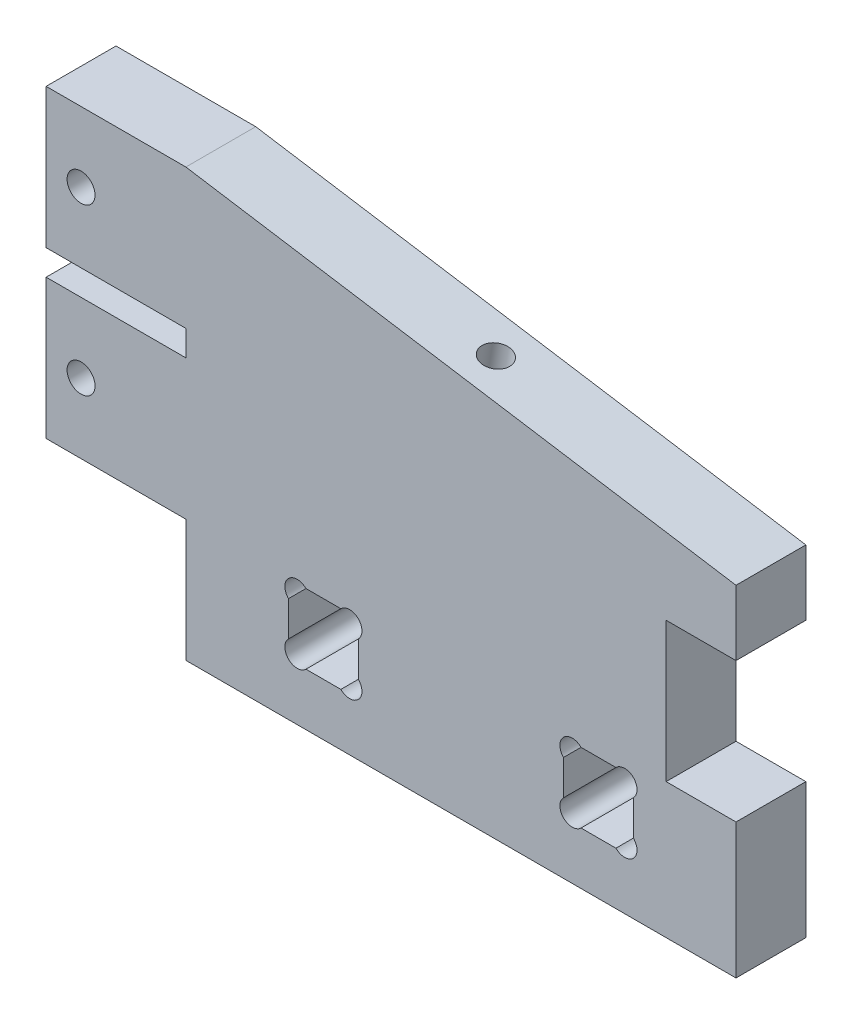
from build123d import *

# Parameters (mm, degrees)
BOSS_EXTRUDE1_DEPTH = 12.7
SKETCH2_R           = 2.54
SKETCH2_W           = 19.05
SKETCH2_H           = 55.44118298
CUT_EXTRUDE2_DEPTH  = 149.871187129
SKETCH3_W           = 100
SKETCH3_H           = 12.958545622
CUT_EXTRUDE3_DEPTH  = 149.871187129
SKETCH5_W           = 100
SKETCH5_H           = 9.525
BOSS_EXTRUDE3_DEPTH = 12.7
SKETCH4_R           = 2.24536
CUT_EXTRUDE4_DEPTH  = 154.464616373
SKETCH6_R           = 4.091253385
SKETCH6_R_2         = 6.05236999
SKETCH6_W           = 12.7
SKETCH6_H           = 25.4
BOSS_EXTRUDE4_DEPTH = 12.7
SKETCH7_R           = 2.54
CUT_EXTRUDE5_DEPTH  = 154.464616373
CUT_EXTRUDE6_DEPTH  = 154.464616373
SKETCH9_R           = 2.54
CUT_EXTRUDE7_DEPTH  = 9.525


with BuildPart() as part:
    # Sketch1 → Boss-Extrude1 (new body)
    with BuildSketch(Plane.XY):
        Polygon((31.75, -68.141601517), (31.75, -55.44118298), (0, -55.44118298), (0, -30.04118298), (19.05, -30.04118298), (31.75, -30.04118298), (31.75, -25.4), (19.05, -25.4), (0, -25.4), (0, 0), (19.05, 0), (31.75, 0), (131.75, -15.838444032), (131.75, -68.141601517), align=None)
    extrude(amount=BOSS_EXTRUDE1_DEPTH)

    # Sketch2 → Cut-Extrude2 (cut, through all)
    with BuildSketch(Plane.XY.offset(12.7)):
        with Locations((25.4, -12.7)):
            Circle(SKETCH2_R)
        with Locations(Location((25.4, -42.74118298, 0), (0, 0, 180))):
            Circle(SKETCH2_R)
        with Locations((9.525, -27.72059149)):
            Rectangle(SKETCH2_W, SKETCH2_H)
    extrude(amount=-CUT_EXTRUDE2_DEPTH, mode=Mode.SUBTRACT)

    # Sketch3 → Cut-Extrude3 (cut, through all)
    with BuildSketch(Plane.XY.offset(12.7)):
        with Locations((81.75, -74.620455791)):
            Rectangle(SKETCH3_W, SKETCH3_H)
    extrude(amount=-CUT_EXTRUDE3_DEPTH, mode=Mode.SUBTRACT)

    # Sketch5 → Boss-Extrude3 (add)
    with BuildSketch(Plane.XY.offset(12.7)):
        with Locations((81.75, -72.90368298)):
            Rectangle(SKETCH5_W, SKETCH5_H)
    extrude(amount=-BOSS_EXTRUDE3_DEPTH)

    # Sketch4 → Cut-Extrude4 (cut, through all)
    with BuildSketch(Plane.XY.offset(12.7)):
        with BuildLine():
            ThreePointArc((53.575418537, -55.44118298), (50.399790718, -55.440973698), (50.4, -58.616601517))
            Line((50.4, -58.616601517), (50.4, -55.44118298))
            Line((50.4, -55.44118298), (53.575418537, -55.44118298))
        make_face()
        with BuildLine():
            Line((50.4, -55.44118298), (50.4, -58.616601517))
            ThreePointArc((50.4, -58.616601517), (52.846898781, -59.103068495), (54.23286, -57.02868298))
            ThreePointArc((54.23286, -57.02868298), (54.06199877, -56.169557621), (53.575418537, -55.44118298))
            Line((53.575418537, -55.44118298), (50.4, -55.44118298))
        make_face()
        with Locations((61.5125, -57.02868298)):
            Circle(SKETCH4_R)
        with Locations((51.9875, -57.02868298)):
            Circle(SKETCH4_R)
        with Locations((51.9875, -66.55368298)):
            Circle(SKETCH4_R)
        with Locations((61.5125, -66.55368298)):
            Circle(SKETCH4_R)
        Polygon((63.1, -68.14118298), (63.1, -55.44118298), (56.75, -55.44118298), (50.4, -55.44118298), (50.4, -68.14118298), (56.75, -68.14118298), align=None)
        with BuildLine():
            ThreePointArc((59.924581463, -55.44118298), (59.924790718, -58.616392262), (63.1, -58.616601517))
            Line((63.1, -58.616601517), (63.1, -55.44118298))
            Line((63.1, -55.44118298), (59.924581463, -55.44118298))
        make_face()
        with BuildLine():
            Line((63.1, -55.44118298), (63.1, -58.616601517))
            ThreePointArc((63.1, -58.616601517), (63.586885515, -57.888081761), (63.75786, -57.02868298))
            ThreePointArc((63.75786, -57.02868298), (62.371625359, -54.95418421), (59.924581463, -55.44118298))
            Line((59.924581463, -55.44118298), (63.1, -55.44118298))
        make_face()
        with BuildLine():
            ThreePointArc((63.1, -64.965764443), (59.924790718, -64.965973698), (59.924581463, -68.14118298))
            Line((59.924581463, -68.14118298), (63.1, -68.14118298))
            Line((63.1, -68.14118298), (63.1, -64.965764443))
        make_face()
        with BuildLine():
            Line((63.1, -68.14118298), (59.924581463, -68.14118298))
            ThreePointArc((59.924581463, -68.14118298), (62.371625359, -68.62818175), (63.75786, -66.55368298))
            ThreePointArc((63.75786, -66.55368298), (63.586885515, -65.694284199), (63.1, -64.965764443))
            Line((63.1, -64.965764443), (63.1, -68.14118298))
        make_face()
        with BuildLine():
            ThreePointArc((50.4, -64.965764443), (50.399790718, -68.141392262), (53.575418537, -68.14118298))
            Line((53.575418537, -68.14118298), (50.4, -68.14118298))
            Line((50.4, -68.14118298), (50.4, -64.965764443))
        make_face()
        with BuildLine():
            Line((50.4, -68.14118298), (53.575418537, -68.14118298))
            ThreePointArc((53.575418537, -68.14118298), (54.06199877, -67.412808338), (54.23286, -66.55368298))
            ThreePointArc((54.23286, -66.55368298), (52.846898781, -64.479297465), (50.4, -64.965764443))
            Line((50.4, -64.965764443), (50.4, -68.14118298))
        make_face()
        with Locations((111.5125, -57.02868298)):
            Circle(SKETCH4_R)
        with Locations((101.9875, -57.02868298)):
            Circle(SKETCH4_R)
        with Locations((101.9875, -66.55368298)):
            Circle(SKETCH4_R)
        with Locations((111.5125, -66.55368298)):
            Circle(SKETCH4_R)
        Polygon((113.1, -68.14118298), (113.1, -55.44118298), (106.75, -55.44118298), (100.4, -55.44118298), (100.4, -68.14118298), (106.75, -68.14118298), align=None)
    extrude(amount=-CUT_EXTRUDE4_DEPTH, mode=Mode.SUBTRACT)

    # Sketch6 → Boss-Extrude4 (add)
    with BuildSketch(Plane.XY.offset(12.7)):
        with Locations((25.4, -12.7)):
            Circle(SKETCH6_R)
        with Locations((25.4, -42.74118298)):
            Circle(SKETCH6_R_2)
        with Locations((12.7, -12.7)):
            Rectangle(SKETCH6_W, SKETCH6_H)
        with Locations((12.7, -42.74118298)):
            Rectangle(SKETCH6_W, SKETCH6_H)
    extrude(amount=-BOSS_EXTRUDE4_DEPTH)

    # Sketch7 → Cut-Extrude5 (cut, through all)
    with BuildSketch(Plane.XY.offset(12.7)):
        with Locations((12.7, -12.7)):
            Circle(SKETCH7_R)
        with Locations(Location((12.7, -42.74118298, 0), (0, 0, 180))):
            Circle(SKETCH7_R)
    extrude(amount=-CUT_EXTRUDE5_DEPTH, mode=Mode.SUBTRACT)

    # Sketch8 → Cut-Extrude6 (cut, through all)
    with BuildSketch(Plane.XY.offset(12.7)):
        Polygon((131.75, -46.752313506), (131.75, -27.702313506), (119.05, -27.702313506), (119.05, -46.752313506), (119.05, -53.102313506), (131.75, -53.102313506), align=None)
    extrude(amount=-CUT_EXTRUDE6_DEPTH, mode=Mode.SUBTRACT)

    # Sketch9 → Cut-Extrude7 (cut)
    with BuildSketch(Plane(origin=(0.776977804, 4.905644786, 0), x_dir=(0.9876883405951382, -0.15643446504022795, 0), z_dir=(0.15643446504022795, 0.9876883405951383, 0))):
        with Locations(Location((81.982361103, -6.35, 0), (0, 0, 180))):
            Circle(SKETCH9_R)
    extrude(amount=-CUT_EXTRUDE7_DEPTH, mode=Mode.SUBTRACT)


solid = part.part
